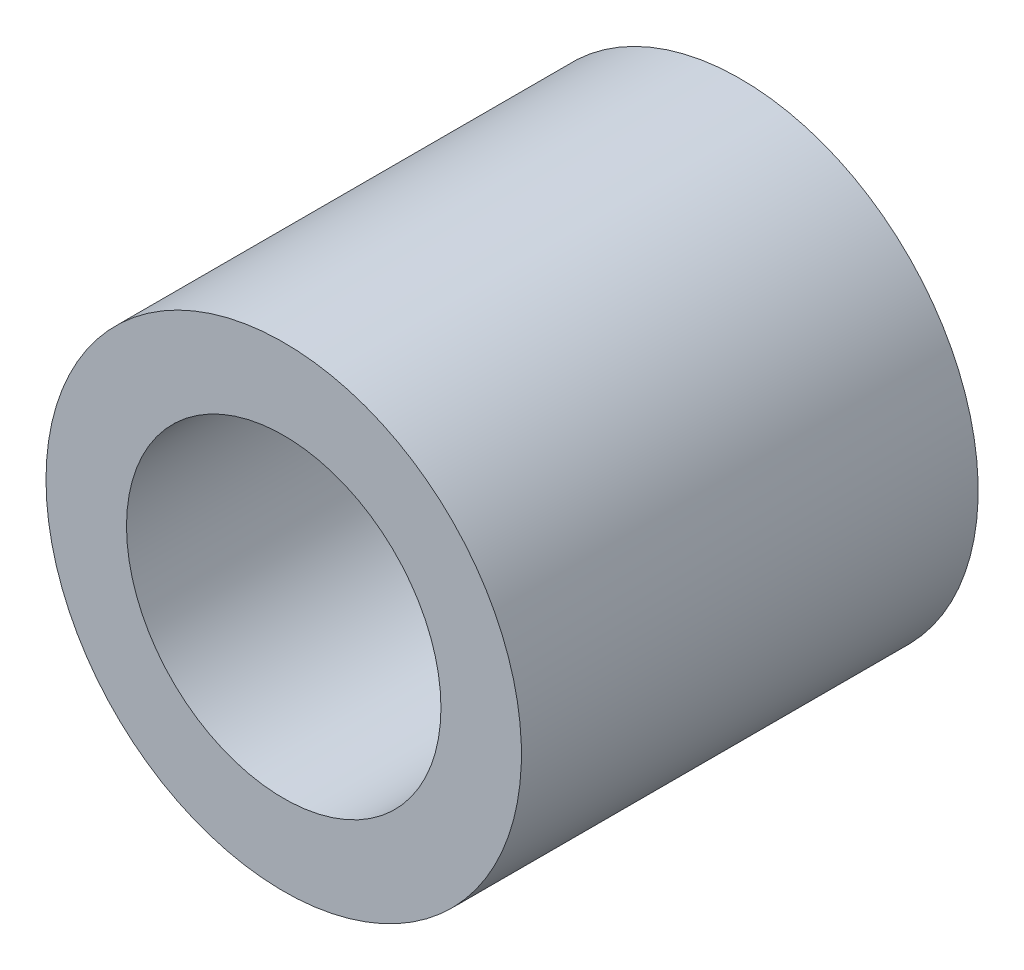
from build123d import *

# Parameters (mm, degrees)
CROQUIS1_R              = 7.9375
CROQUIS1_R_2            = 5.25
SALIENTE_EXTRUIR1_DEPTH = 15.25


with BuildPart() as part:
    # Croquis1 → Saliente-Extruir1 (new body)
    with BuildSketch(Plane.XY):
        with Locations(Location((0, 0, 0), (0, 0, 180))):
            Circle(CROQUIS1_R)
        with Locations(Location((0, 0, 0), (0, 0, 180))):
            Circle(CROQUIS1_R_2, mode=Mode.SUBTRACT)
    extrude(amount=SALIENTE_EXTRUIR1_DEPTH)


solid = part.part
